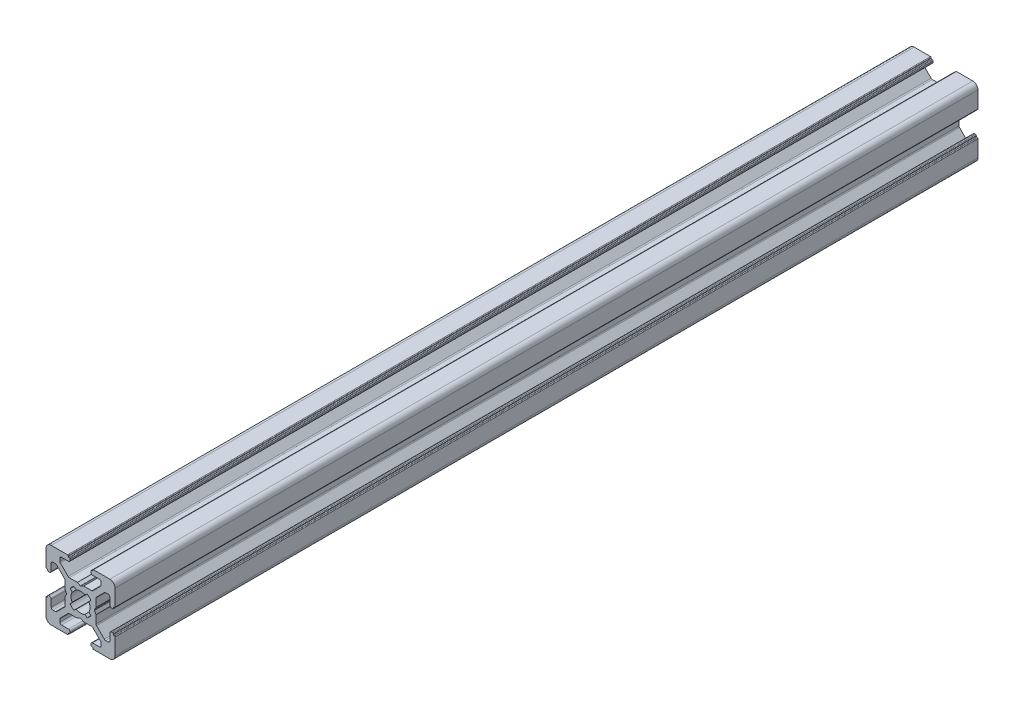
from build123d import *

# Parameters (mm, degrees)
EXTRUDE1_DEPTH = 250


with BuildPart() as part:
    # Sketch1 → Extrude1 (new body)
    with BuildSketch(Plane.XY):
        with BuildLine():
            Line((-3.5, 8.499999673), (-5.500000686, 8.499999673))
            ThreePointArc((-5.500000686, 8.499999673), (-5.853554077, 8.353553064), (-6.000000686, 7.999999673))
            Line((-6.000000686, 7.999999673), (-6.000000686, 7.267766626))
            ThreePointArc((-6.000000686, 7.267766626), (-5.961940448, 7.076424899), (-5.853554059, 6.914213219))
            Line((-5.853554059, 6.914213219), (-3.585787212, 4.646446592))
            ThreePointArc((-3.585787212, 4.646446592), (-3.423575544, 4.538060229), (-3.232233839, 4.5))
            Line((-3.232233839, 4.5), (-0.953590312, 4.5))
            ThreePointArc((-0.953590312, 4.5), (-0.901826505, 4.493185166), (-0.853590316, 4.473205083))
            Line((-0.853590316, 4.473205083), (-0.100000045, 4.038119562))
            ThreePointArc((-0.100000045, 4.038119562), (0, 4.011324632), (0.100000045, 4.038119562))
            Line((0.100000045, 4.038119562), (0.853590316, 4.473205083))
            ThreePointArc((0.853590316, 4.473205083), (0.901826505, 4.493185166), (0.953590312, 4.5))
            Line((0.953590312, 4.5), (3.232233839, 4.5))
            ThreePointArc((3.232233839, 4.5), (3.423575544, 4.538060229), (3.585787212, 4.646446592))
            Line((3.585787212, 4.646446592), (5.853554059, 6.914213219))
            ThreePointArc((5.853554059, 6.914213219), (5.961940448, 7.076424899), (6.000000686, 7.267766626))
            Line((6.000000686, 7.267766626), (6.000000686, 7.999999673))
            ThreePointArc((6.000000686, 7.999999673), (5.853554077, 8.353553064), (5.500000686, 8.499999673))
            Line((5.500000686, 8.499999673), (3.5, 8.499999673))
            ThreePointArc((3.5, 8.499999673), (3.146446609, 8.646446283), (3, 8.999999673))
            Line((3, 8.999999673), (3, 9.3))
            ThreePointArc((3, 9.3), (3.058578644, 9.441421356), (3.2, 9.5))
            Line((3.2, 9.5), (3.350000228, 9.5))
            ThreePointArc((3.350000228, 9.5), (3.491421584, 9.558578644), (3.550000228, 9.7))
            Line((3.550000228, 9.7), (3.550000228, 9.8))
            ThreePointArc((3.550000228, 9.8), (3.608578871, 9.941421356), (3.750000228, 10))
            Line((3.750000228, 10), (8.5, 10))
            ThreePointArc((8.5, 10), (9.560660172, 9.560660172), (10, 8.5))
            Line((10, 8.5), (10, 3.749999605))
            ThreePointArc((10, 3.749999605), (9.941421356, 3.608578248), (9.8, 3.549999605))
            Line((9.8, 3.549999605), (9.699999732, 3.549999605))
            ThreePointArc((9.699999732, 3.549999605), (9.558578376, 3.491420961), (9.499999732, 3.349999605))
            Line((9.499999732, 3.349999605), (9.499999732, 3.2))
            ThreePointArc((9.499999732, 3.2), (9.441421088, 3.058578644), (9.299999732, 3))
            Line((9.299999732, 3), (8.999999732, 3))
            ThreePointArc((8.999999732, 3), (8.646446341, 3.146446609), (8.499999732, 3.5))
            Line((8.499999732, 3.5), (8.499999732, 5.499999605))
            ThreePointArc((8.499999732, 5.499999605), (8.353553123, 5.853552995), (7.999999732, 5.999999605))
            Line((7.999999732, 5.999999605), (7.267766685, 5.999999605))
            ThreePointArc((7.267766685, 5.999999605), (7.076424969, 5.961939371), (6.914213294, 5.853552995))
            Line((6.914213294, 5.853552995), (4.646446398, 3.585786099))
            ThreePointArc((4.646446398, 3.585786099), (4.538060023, 3.423574425), (4.499999789, 3.232232708))
            Line((4.499999789, 3.232232708), (4.499999789, 0.953589302))
            ThreePointArc((4.499999789, 0.953589302), (4.493184953, 0.90182549), (4.473204867, 0.853589297))
            Line((4.473204867, 0.853589297), (4.038119841, 0.099999969))
            ThreePointArc((4.038119841, 0.099999969), (4.011324929, 0), (4.038119841, -0.099999969))
            Line((4.038119841, -0.099999969), (4.473204867, -0.853589297))
            ThreePointArc((4.473204867, -0.853589297), (4.493184953, -0.90182549), (4.499999789, -0.953589302))
            Line((4.499999789, -0.953589302), (4.499999789, -3.232232708))
            ThreePointArc((4.499999789, -3.232232708), (4.538060023, -3.423574425), (4.646446398, -3.585786099))
            Line((4.646446398, -3.585786099), (6.914213294, -5.853552995))
            ThreePointArc((6.914213294, -5.853552995), (7.076424969, -5.961939371), (7.267766685, -5.999999605))
            Line((7.267766685, -5.999999605), (7.999999732, -5.999999605))
            ThreePointArc((7.999999732, -5.999999605), (8.353553123, -5.853552995), (8.499999732, -5.499999605))
            Line((8.499999732, -5.499999605), (8.499999732, -3.5))
            ThreePointArc((8.499999732, -3.5), (8.646446341, -3.146446609), (8.999999732, -3))
            Line((8.999999732, -3), (9.299999732, -3))
            ThreePointArc((9.299999732, -3), (9.441421088, -3.058578644), (9.499999732, -3.2))
            Line((9.499999732, -3.2), (9.499999732, -3.349999605))
            ThreePointArc((9.499999732, -3.349999605), (9.558578376, -3.491420961), (9.699999732, -3.549999605))
            Line((9.699999732, -3.549999605), (9.8, -3.549999605))
            ThreePointArc((9.8, -3.549999605), (9.941421356, -3.608578248), (10, -3.749999605))
            Line((10, -3.749999605), (10, -8.5))
            ThreePointArc((10, -8.5), (9.560660172, -9.560660172), (8.5, -10))
            Line((8.5, -10), (3.750000228, -10))
            ThreePointArc((3.750000228, -10), (3.608578871, -9.941421356), (3.550000228, -9.8))
            Line((3.550000228, -9.8), (3.550000228, -9.7))
            ThreePointArc((3.550000228, -9.7), (3.491421584, -9.558578644), (3.350000228, -9.5))
            Line((3.350000228, -9.5), (3.2, -9.5))
            ThreePointArc((3.2, -9.5), (3.058578644, -9.441421356), (3, -9.3))
            Line((3, -9.3), (3, -8.999999673))
            ThreePointArc((3, -8.999999673), (3.146446609, -8.646446283), (3.5, -8.499999673))
            Line((3.5, -8.499999673), (5.500000686, -8.499999673))
            ThreePointArc((5.500000686, -8.499999673), (5.853554077, -8.353553064), (6.000000686, -7.999999673))
            Line((6.000000686, -7.999999673), (6.000000686, -7.267766626))
            ThreePointArc((6.000000686, -7.267766626), (5.961940448, -7.076424899), (5.853554059, -6.914213219))
            Line((5.853554059, -6.914213219), (3.585787212, -4.646446592))
            ThreePointArc((3.585787212, -4.646446592), (3.423575544, -4.538060229), (3.232233839, -4.5))
            Line((3.232233839, -4.5), (0.953590312, -4.5))
            ThreePointArc((0.953590312, -4.5), (0.901826505, -4.493185166), (0.853590316, -4.473205083))
            Line((0.853590316, -4.473205083), (0.100000045, -4.038119562))
            ThreePointArc((0.100000045, -4.038119562), (0, -4.011324632), (-0.100000045, -4.038119562))
            Line((-0.100000045, -4.038119562), (-0.853590316, -4.473205083))
            ThreePointArc((-0.853590316, -4.473205083), (-0.901826505, -4.493185166), (-0.953590312, -4.5))
            Line((-0.953590312, -4.5), (-3.232233839, -4.5))
            ThreePointArc((-3.232233839, -4.5), (-3.423575544, -4.538060229), (-3.585787212, -4.646446592))
            Line((-3.585787212, -4.646446592), (-5.853554059, -6.914213219))
            ThreePointArc((-5.853554059, -6.914213219), (-5.961940448, -7.076424899), (-6.000000686, -7.267766626))
            Line((-6.000000686, -7.267766626), (-6.000000686, -7.999999673))
            ThreePointArc((-6.000000686, -7.999999673), (-5.853554077, -8.353553064), (-5.500000686, -8.499999673))
            Line((-5.500000686, -8.499999673), (-3.5, -8.499999673))
            ThreePointArc((-3.5, -8.499999673), (-3.146446609, -8.646446283), (-3, -8.999999673))
            Line((-3, -8.999999673), (-3, -9.3))
            ThreePointArc((-3, -9.3), (-3.058578644, -9.441421356), (-3.2, -9.5))
            Line((-3.2, -9.5), (-3.350000228, -9.5))
            ThreePointArc((-3.350000228, -9.5), (-3.491421584, -9.558578644), (-3.550000228, -9.7))
            Line((-3.550000228, -9.7), (-3.550000228, -9.8))
            ThreePointArc((-3.550000228, -9.8), (-3.608578871, -9.941421356), (-3.750000228, -10))
            Line((-3.750000228, -10), (-8.5, -10))
            ThreePointArc((-8.5, -10), (-9.560660172, -9.560660172), (-10, -8.5))
            Line((-10, -8.5), (-10, -3.749999605))
            ThreePointArc((-10, -3.749999605), (-9.941421356, -3.608578248), (-9.8, -3.549999605))
            Line((-9.8, -3.549999605), (-9.699999732, -3.549999605))
            ThreePointArc((-9.699999732, -3.549999605), (-9.558578376, -3.491420961), (-9.499999732, -3.349999605))
            Line((-9.499999732, -3.349999605), (-9.499999732, -3.2))
            ThreePointArc((-9.499999732, -3.2), (-9.441421088, -3.058578644), (-9.299999732, -3))
            Line((-9.299999732, -3), (-8.999999732, -3))
            ThreePointArc((-8.999999732, -3), (-8.646446341, -3.146446609), (-8.499999732, -3.5))
            Line((-8.499999732, -3.5), (-8.499999732, -5.499999605))
            ThreePointArc((-8.499999732, -5.499999605), (-8.353553123, -5.853552995), (-7.999999732, -5.999999605))
            Line((-7.999999732, -5.999999605), (-7.267766685, -5.999999605))
            ThreePointArc((-7.267766685, -5.999999605), (-7.076424969, -5.961939371), (-6.914213294, -5.853552995))
            Line((-6.914213294, -5.853552995), (-4.646446398, -3.585786099))
            ThreePointArc((-4.646446398, -3.585786099), (-4.538060023, -3.423574425), (-4.499999789, -3.232232708))
            Line((-4.499999789, -3.232232708), (-4.499999789, -0.953589302))
            ThreePointArc((-4.499999789, -0.953589302), (-4.493184953, -0.90182549), (-4.473204867, -0.853589297))
            Line((-4.473204867, -0.853589297), (-4.038119841, -0.099999969))
            ThreePointArc((-4.038119841, -0.099999969), (-4.011324929, 0), (-4.038119841, 0.099999969))
            Line((-4.038119841, 0.099999969), (-4.473204867, 0.853589297))
            ThreePointArc((-4.473204867, 0.853589297), (-4.493184953, 0.90182549), (-4.499999789, 0.953589302))
            Line((-4.499999789, 0.953589302), (-4.499999789, 3.232232708))
            ThreePointArc((-4.499999789, 3.232232708), (-4.538060023, 3.423574425), (-4.646446398, 3.585786099))
            Line((-4.646446398, 3.585786099), (-6.914213294, 5.853552995))
            ThreePointArc((-6.914213294, 5.853552995), (-7.076424969, 5.961939371), (-7.267766685, 5.999999605))
            Line((-7.267766685, 5.999999605), (-7.999999732, 5.999999605))
            ThreePointArc((-7.999999732, 5.999999605), (-8.353553123, 5.853552995), (-8.499999732, 5.499999605))
            Line((-8.499999732, 5.499999605), (-8.499999732, 3.5))
            ThreePointArc((-8.499999732, 3.5), (-8.646446341, 3.146446609), (-8.999999732, 3))
            Line((-8.999999732, 3), (-9.299999732, 3))
            ThreePointArc((-9.299999732, 3), (-9.441421088, 3.058578644), (-9.499999732, 3.2))
            Line((-9.499999732, 3.2), (-9.499999732, 3.349999605))
            ThreePointArc((-9.499999732, 3.349999605), (-9.558578376, 3.491420961), (-9.699999732, 3.549999605))
            Line((-9.699999732, 3.549999605), (-9.8, 3.549999605))
            ThreePointArc((-9.8, 3.549999605), (-9.941421356, 3.608578248), (-10, 3.749999605))
            Line((-10, 3.749999605), (-10, 8.5))
            ThreePointArc((-10, 8.5), (-9.560660172, 9.560660172), (-8.5, 10))
            Line((-8.5, 10), (-3.750000228, 10))
            ThreePointArc((-3.750000228, 10), (-3.608578871, 9.941421356), (-3.550000228, 9.8))
            Line((-3.550000228, 9.8), (-3.550000228, 9.7))
            ThreePointArc((-3.550000228, 9.7), (-3.491421584, 9.558578644), (-3.350000228, 9.5))
            Line((-3.350000228, 9.5), (-3.2, 9.5))
            ThreePointArc((-3.2, 9.5), (-3.058578644, 9.441421356), (-3, 9.3))
            Line((-3, 9.3), (-3, 8.999999673))
            ThreePointArc((-3, 8.999999673), (-3.146446609, 8.646446283), (-3.5, 8.499999673))
        make_face()
        with BuildLine():
            Line((-1.258185436, 2.445295362), (-1.91389502, 2.989640962))
            ThreePointArc((-1.91389502, 2.989640962), (-2.511737261, 2.508410485), (-2.992174953, 1.909930962))
            Line((-2.992174953, 1.909930962), (-2.445295423, 1.258185317))
            ThreePointArc((-2.445295423, 1.258185317), (-2.75, 0), (-2.445295423, -1.258185317))
            Line((-2.445295423, -1.258185317), (-2.992174953, -1.909930962))
            ThreePointArc((-2.992174953, -1.909930962), (-2.511737261, -2.508410485), (-1.91389502, -2.989640962))
            Line((-1.91389502, -2.989640962), (-1.258185436, -2.445295362))
            ThreePointArc((-1.258185436, -2.445295362), (0, -2.75), (1.258185436, -2.445295362))
            Line((1.258185436, -2.445295362), (1.91389502, -2.989640962))
            ThreePointArc((1.91389502, -2.989640962), (2.511737261, -2.508410485), (2.992174953, -1.909930962))
            Line((2.992174953, -1.909930962), (2.445295423, -1.258185317))
            ThreePointArc((2.445295423, -1.258185317), (2.75, 0), (2.445295423, 1.258185317))
            Line((2.445295423, 1.258185317), (2.992174953, 1.909930962))
            ThreePointArc((2.992174953, 1.909930962), (2.511737261, 2.508410485), (1.91389502, 2.989640962))
            Line((1.91389502, 2.989640962), (1.258185436, 2.445295362))
            ThreePointArc((1.258185436, 2.445295362), (0, 2.75), (-1.258185436, 2.445295362))
        make_face(mode=Mode.SUBTRACT)
    extrude(amount=EXTRUDE1_DEPTH)


solid = part.part
